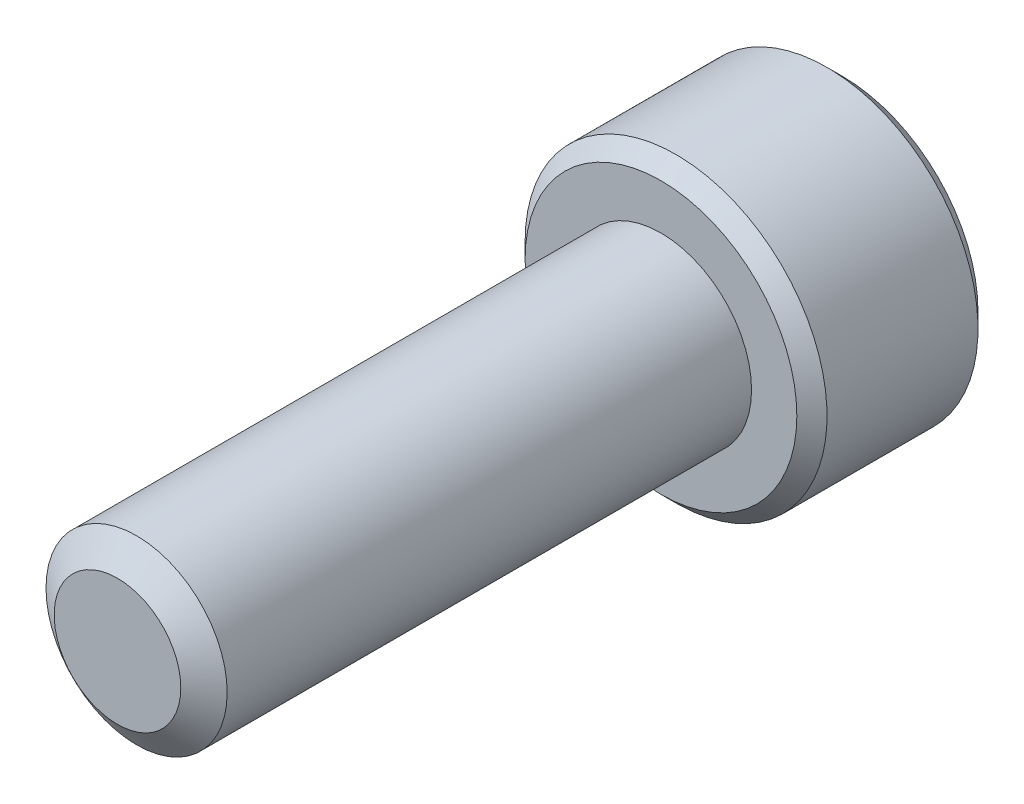
from build123d import *

# Parameters (mm, degrees)
SKETCH1_R          = 3
EXTRUDE1_DEPTH     = 18
SKETCH6_R          = 5
EXTRUDE2_DEPTH     = 6
CUT_EXTRUDE1_DEPTH = 3.75
CHAMFER1_SIZE      = 0.5


with BuildPart() as part:
    # Sketch1 → Extrude1 (new body)
    with BuildSketch(Plane.XY):
        Circle(SKETCH1_R)
    extrude(amount=-EXTRUDE1_DEPTH)

    # Sketch4 → Cut-Revolve1 (revolve, cut)
    with BuildSketch(Plane(origin=(0, 0, 0), x_dir=(0, 0, -1), z_dir=(1, 0, 0))):
        Polygon((0.632650852, 3), (0, 2.096480947), (0, 3), align=None)
    revolve(axis=Axis((0, 0, 0), (0, 0, -1)), mode=Mode.SUBTRACT)

    # Sketch6 → Extrude2 (add)
    with BuildSketch(Plane(origin=(0, 0, -18), x_dir=(-1, 0, 0), z_dir=(0, 0, -1))):
        Circle(SKETCH6_R)
    extrude(amount=EXTRUDE2_DEPTH)

    # Sketch7 → Cut-Extrude1 (cut)
    with BuildSketch(Plane(origin=(0, 0, -24), x_dir=(-1, 0, 0), z_dir=(0, 0, -1))):
        Polygon((0, 2.886751346), (-2.5, 1.443375673), (-2.5, -1.443375673), (0, -2.886751346), (2.5, -1.443375673), (2.5, 1.443375673), align=None)
    extrude(amount=-CUT_EXTRUDE1_DEPTH, mode=Mode.SUBTRACT)

    # Chamfer1
    chamfer1_edges = [part.edges().sort_by_distance(p)[0] for p in [
        (5, 0, -24),
        (5, 0, -18),
    ]]
    chamfer(chamfer1_edges, length=CHAMFER1_SIZE)


solid = part.part
